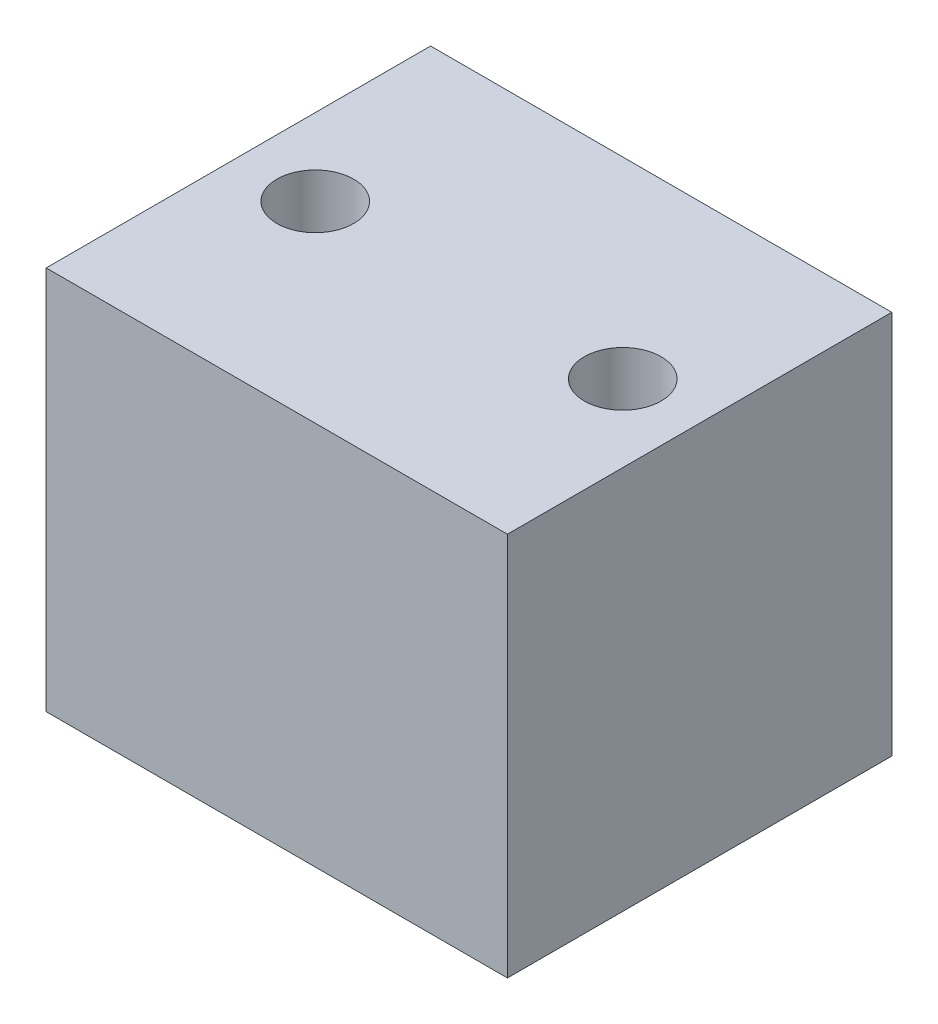
from build123d import *

# Parameters (mm, degrees)
SKETCH1_W           = 30
SKETCH1_H           = 25
SKETCH1_R           = 2.5
BOSS_EXTRUDE1_DEPTH = 25


with BuildPart() as part:
    # Sketch1 → Boss-Extrude1 (new body)
    with BuildSketch(Plane(origin=(0, 0, 0), x_dir=(1, 0, 0), z_dir=(0, 1, 0))):
        Rectangle(SKETCH1_W, SKETCH1_H)
        with Locations(Location((-10, 0, 0), (0, 0, 270))):
            Circle(SKETCH1_R, mode=Mode.SUBTRACT)
        with Locations(Location((10, 0, 0), (0, 0, 270))):
            Circle(SKETCH1_R, mode=Mode.SUBTRACT)
    extrude(amount=BOSS_EXTRUDE1_DEPTH)


solid = part.part
